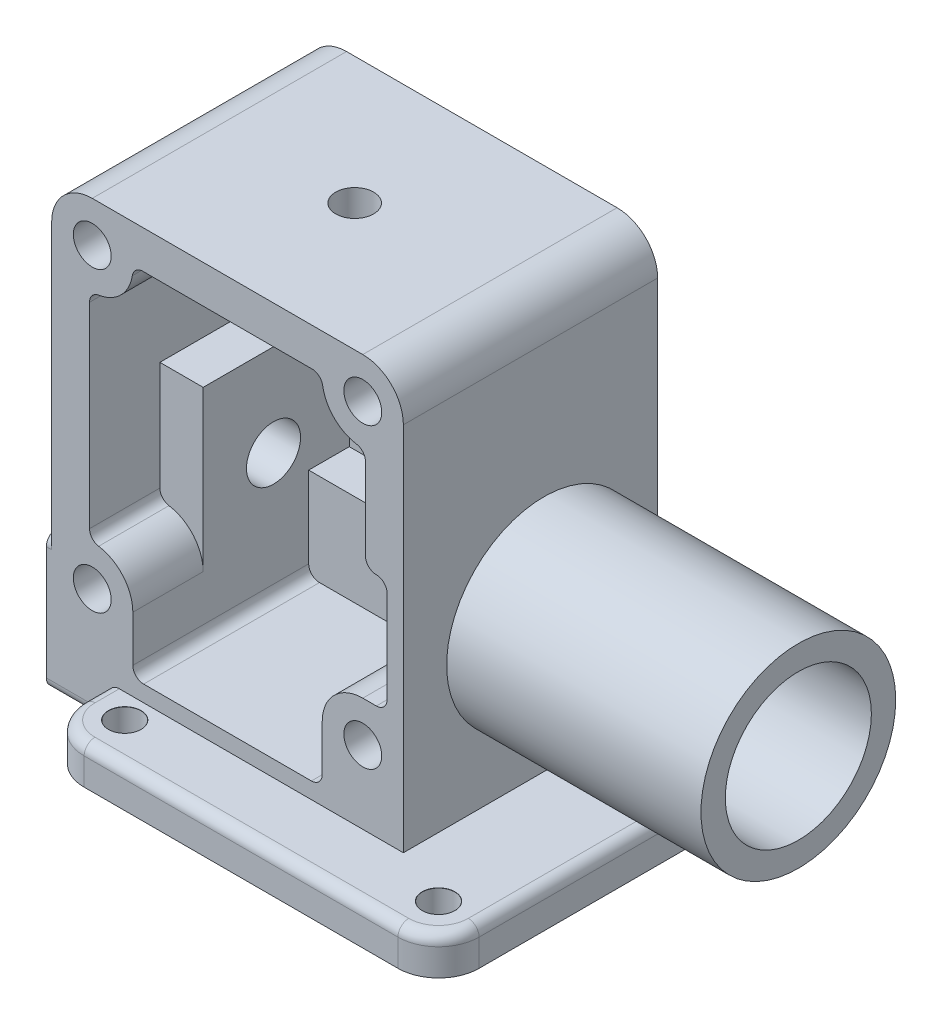
from build123d import *

# Parameters (mm, degrees)
BOSS_EXTRUDE1_DEPTH             = 7
F_6_0MM_DOWEL_HOLE1_D           = 6
F_6_0MM_DOWEL_HOLE1_CSINK_D     = 6.05
F_6_0MM_DOWEL_HOLE1_CSINK_ANGLE = 90
BOSS_EXTRUDE2_DEPTH             = 76
BOSS_EXTRUDE2_DEPTH_BACK        = 7
SKETCH5_W                       = 65
SKETCH5_H                       = 47
FILLET1_R                       = 7.5
F_6_0MM_DOWEL_HOLE2_D           = 7
CUT_EXTRUDE1_DEPTH              = 40
BOSS_EXTRUDE3_START             = 27
BOSS_EXTRUDE3_DEPTH             = 27
BOSS_EXTRUDE4_START             = 7.5
BOSS_EXTRUDE4_DEPTH             = 7.5
F_6_0MM_DOWEL_HOLE3_D           = 6
CUT_EXTRUDE2_DEPTH              = 14.5
BOSS_EXTRUDE5_DEPTH             = 1
F_5_0MM_DOWEL_HOLE1_D           = 5
F_5_0MM_DOWEL_HOLE1_DEPTH       = 13
F_5_0MM_DOWEL_HOLE1_TIP         = 1.502151548
BOSS_EXTRUDE6_DEPTH             = 2
CUT_EXTRUDE4_DEPTH              = 11.5
SKETCH27_R                      = 9
CUT_EXTRUDE5_DEPTH              = 30
SKETCH28_R                      = 5
CUT_EXTRUDE6_DEPTH              = 100
SKETCH29_R                      = 18
BOSS_EXTRUDE7_DEPTH             = 47
SKETCH30_R                      = 13.5
CUT_EXTRUDE7_DEPTH              = 37
SKETCH31_R                      = 12
CUT_EXTRUDE8_DEPTH              = 5
SKETCH32_R                      = 5
CUT_EXTRUDE9_DEPTH              = 116.161842639
SKETCH33_R                      = 3.5
CUT_EXTRUDE10_DEPTH             = 10
FILLET4_R                       = 2


with BuildPart() as part:
    # Sketch2 → Boss-Extrude1 (new body)
    with BuildSketch(Plane(origin=(0, 0, 0), x_dir=(1, 0, 0), z_dir=(0, 1, 0))):
        with BuildLine():
            Line((-29, -36.5), (29, -36.5))
            ThreePointArc((29, -36.5), (34.303300859, -34.303300859), (36.5, -29))
            Line((36.5, -29), (36.5, 29))
            ThreePointArc((36.5, 29), (34.303300859, 34.303300859), (29, 36.5))
            Line((29, 36.5), (-29, 36.5))
            ThreePointArc((-29, 36.5), (-34.303300859, 34.303300859), (-36.5, 29))
            Line((-36.5, 29), (-36.5, -29))
            ThreePointArc((-36.5, -29), (-34.303300859, -34.303300859), (-29, -36.5))
        make_face()
    extrude(amount=BOSS_EXTRUDE1_DEPTH)

    # Ø6.0mm Dowel Hole1 (through all)
    with Locations(Plane(origin=(-29, 7, -29), x_dir=(0, 0, 1), z_dir=(0, 1, 0))):
        with Locations((0, 0), (0, 58), (58, 58), (58, 0)):
            CounterSinkHole(F_6_0MM_DOWEL_HOLE1_D / 2, F_6_0MM_DOWEL_HOLE1_CSINK_D / 2, counter_sink_angle=F_6_0MM_DOWEL_HOLE1_CSINK_ANGLE)

    # Sketch5 → Boss-Extrude2 (add, two sides: drawn at the far end of the back side and taken through both)
    with BuildSketch(Plane(origin=(0, 7, 0), x_dir=(1, 0, 0), z_dir=(0, 1, 0)).offset(-BOSS_EXTRUDE2_DEPTH_BACK)):
        with Locations((-14.5, -1)):
            Rectangle(SKETCH5_W, SKETCH5_H)
    extrude(amount=BOSS_EXTRUDE2_DEPTH + BOSS_EXTRUDE2_DEPTH_BACK)

    # Fillet1
    fillet1_edges = [part.edges().sort_by_distance(p)[0] for p in [
        (18, 83, 1),
        (-47, 83, 1),
    ]]
    fillet(fillet1_edges, radius=FILLET1_R)

    # Ø6.0mm Dowel Hole2 (through all)
    with Locations(Plane(origin=(-39.5, 75.5, 24.5), x_dir=(1, 0, 0), z_dir=(0, 0, 1))):
        with Locations((0, 0), (50, 0), (0, -55), (50, -55)):
            Hole(F_6_0MM_DOWEL_HOLE2_D / 2)

    # Sketch9 → Cut-Extrude1 (cut)
    with BuildSketch(Plane.XY.offset(24.5)):
        with BuildLine():
            Line((11, 66.11916848), (11, 51))
            ThreePointArc((11, 51), (11.585786438, 49.585786438), (13, 49))
            ThreePointArc((13, 49), (14.414213562, 48.414213562), (15, 47))
            Line((15, 47), (15, 30))
            ThreePointArc((15, 30), (14.414213562, 28.585786438), (13, 28))
            Line((13, 28), (10.5, 28))
            ThreePointArc((10.5, 28), (5.196699141, 25.803300859), (3, 20.5))
            Line((3, 20.5), (3, 12))
            ThreePointArc((3, 12), (2.414213562, 10.585786438), (1, 10))
            Line((1, 10), (-30, 10))
            ThreePointArc((-30, 10), (-31.414213562, 10.585786438), (-32, 12))
            Line((-32, 12), (-32, 20.5))
            ThreePointArc((-32, 20.5), (-33.793355673, 25.366642634), (-38.315789474, 27.905919621))
            ThreePointArc((-38.315789474, 27.905919621), (-39.521771821, 28.583060151), (-40, 29.88083152))
            Line((-40, 29.88083152), (-40, 66.11916848))
            ThreePointArc((-40, 66.11916848), (-39.521771821, 67.416939849), (-38.315789474, 68.094080379))
            ThreePointArc((-38.315789474, 68.094080379), (-34.196699141, 70.196699141), (-32.094080379, 74.315789474))
            ThreePointArc((-32.094080379, 74.315789474), (-31.416939849, 75.521771821), (-30.11916848, 76))
            Line((-30.11916848, 76), (1.11916848, 76))
            ThreePointArc((1.11916848, 76), (2.416939849, 75.521771821), (3.094080379, 74.315789474))
            ThreePointArc((3.094080379, 74.315789474), (5.196699141, 70.196699141), (9.315789474, 68.094080379))
            ThreePointArc((9.315789474, 68.094080379), (10.521771821, 67.416939849), (11, 66.11916848))
        make_face()
    extrude(amount=-CUT_EXTRUDE1_DEPTH, mode=Mode.SUBTRACT)

    # Sketch11 → Boss-Extrude3 (add)
    with BuildSketch(Plane.XY.offset(-15.5).offset(BOSS_EXTRUDE3_START)):
        with BuildLine():
            Line((-32, 20.5), (-32, 50))
            Line((-32, 50), (-40, 50))
            Line((-40, 50), (-40, 29.88083152))
            ThreePointArc((-40, 29.88083152), (-39.521771821, 28.583060151), (-38.315789474, 27.905919621))
            ThreePointArc((-38.315789474, 27.905919621), (-33.793355673, 25.366642634), (-32, 20.5))
        make_face()
    extrude(amount=-BOSS_EXTRUDE3_DEPTH)

    # Sketch12 → Boss-Extrude4 (add)
    with BuildSketch(Plane.XY.offset(-15.5).offset(BOSS_EXTRUDE4_START)):
        with BuildLine():
            Line((-9.5, 10), (-9.5, 19.5))
            ThreePointArc((-9.5, 19.5), (-11.696699141, 24.803300859), (-17, 27))
            Line((-17, 27), (-32, 27))
            Line((-32, 27), (-32, 12))
            ThreePointArc((-32, 12), (-31.414213562, 10.585786438), (-30, 10))
            Line((-30, 10), (-9.5, 10))
        make_face()
    extrude(amount=-BOSS_EXTRUDE4_DEPTH)

    # Ø6.0mm Dowel Hole3 (through all)
    with Locations(Plane(origin=(-17, 19.5, -8), x_dir=(1, 0, 0), z_dir=(0, 0, 1))):
        with Locations((0, 0)):
            Hole(F_6_0MM_DOWEL_HOLE3_D / 2)

    # Sketch14 → Cut-Extrude2 (cut)
    with BuildSketch(Plane(origin=(0, 0, -22.5), x_dir=(-1, 0, 0), z_dir=(0, 0, -1))):
        with BuildLine():
            Line((-5.832809465, 48), (-5.832809465, 30))
            ThreePointArc((-5.832809465, 30), (2.167190535, 22), (10.167190535, 30))
            Line((10.167190535, 30), (10.167190535, 48))
            ThreePointArc((10.167190535, 48), (2.167190535, 56), (-5.832809465, 48))
        make_face()
    extrude(amount=-CUT_EXTRUDE2_DEPTH, mode=Mode.SUBTRACT)

    # Sketch15 → Boss-Extrude5 (add)
    with BuildSketch(Plane.ZY.offset(47)):
        with BuildLine():
            Line((24.5, 0), (-22.5, 0))
            Line((-22.5, 0), (-22.5, 23))
            ThreePointArc((-22.5, 23), (-21.914213562, 24.414213562), (-20.5, 25))
            Line((-20.5, 25), (22.5, 25))
            ThreePointArc((22.5, 25), (23.914213562, 24.414213562), (24.5, 23))
            Line((24.5, 23), (24.5, 0))
        make_face()
    extrude(amount=BOSS_EXTRUDE5_DEPTH)

    # Ø5.0mm Dowel Hole1
    with Locations(Plane(origin=(-48, 12.5, 18.5), x_dir=(0, 0, -1), z_dir=(-1, 0, 0))):
        with Locations((0, 0), (37, 0)):
            Hole(F_5_0MM_DOWEL_HOLE1_D / 2, depth=F_5_0MM_DOWEL_HOLE1_DEPTH)
            with Locations((0, 0, -(F_5_0MM_DOWEL_HOLE1_DEPTH + F_5_0MM_DOWEL_HOLE1_TIP / 2))):  # 118° drill point
                Cone(0, F_5_0MM_DOWEL_HOLE1_D / 2, F_5_0MM_DOWEL_HOLE1_TIP, mode=Mode.SUBTRACT)

    # Sketch21 → Boss-Extrude6 (add)
    with BuildSketch(Plane(origin=(0, 0, -22.5), x_dir=(-1, 0, 0), z_dir=(0, 0, -1))):
        Polygon((48, 0), (36.5, 0), (36.5, 7), (-18, 7), (-18, 12), (48, 12), align=None)
    extrude(amount=BOSS_EXTRUDE6_DEPTH)

    # Sketch23 → Cut-Extrude4 (cut)
    with BuildSketch(Plane.ZY.offset(48)):
        with BuildLine():
            Line((-22.5, 0), (-24.5, 0))
            Line((-24.5, 0), (-24.5, 2))
            ThreePointArc((-24.5, 2), (-23.914213562, 0.585786438), (-22.5, 0))
        make_face()
        with BuildLine():
            Line((24.5, 0), (22.5, 0))
            ThreePointArc((22.5, 0), (23.914213562, 0.585786438), (24.5, 2))
            Line((24.5, 2), (24.5, 0))
        make_face()
    extrude(amount=-CUT_EXTRUDE4_DEPTH, mode=Mode.SUBTRACT)

    # Sketch27 → Cut-Extrude5 (cut)
    with BuildSketch(Plane.XZ):
        with Locations(Location((0, 0, 0), (0, 0, 270))):
            Circle(SKETCH27_R)
    extrude(amount=-CUT_EXTRUDE5_DEPTH, mode=Mode.SUBTRACT)

    # Sketch28 → Cut-Extrude6 (cut)
    with BuildSketch(Plane.ZY.offset(47)):
        with Locations(Location((-1.5, 33, 0), (0, 0, 323.130102354))):
            Circle(SKETCH28_R)
    extrude(amount=-CUT_EXTRUDE6_DEPTH, mode=Mode.SUBTRACT)

    # Sketch29 → Boss-Extrude7 (add)
    with BuildSketch(Plane(origin=(18, 0, 0), x_dir=(0, 0, -1), z_dir=(1, 0, 0))):
        with Locations((1.5, 33)):
            Circle(SKETCH29_R)
    extrude(amount=BOSS_EXTRUDE7_DEPTH)

    # Sketch30 → Cut-Extrude7 (cut)
    with BuildSketch(Plane(origin=(65, 0, 0), x_dir=(0, 0, -1), z_dir=(1, 0, 0))):
        with Locations((1.5, 33)):
            Circle(SKETCH30_R)
    extrude(amount=-CUT_EXTRUDE7_DEPTH, mode=Mode.SUBTRACT)

    # Sketch31 → Cut-Extrude8 (cut)
    with BuildSketch(Plane(origin=(28, 0, 0), x_dir=(0, 0, -1), z_dir=(1, 0, 0))):
        with Locations((1.5, 33)):
            Circle(SKETCH31_R)
    extrude(amount=-CUT_EXTRUDE8_DEPTH, mode=Mode.SUBTRACT)

    # Sketch32 → Cut-Extrude9 (cut, through all)
    with BuildSketch(Plane(origin=(23, 0, 0), x_dir=(0, 0, -1), z_dir=(1, 0, 0))):
        with Locations(Location((1.5, 33, 0), (0, 0, 216.869897646))):
            Circle(SKETCH32_R)
    extrude(amount=-CUT_EXTRUDE9_DEPTH, mode=Mode.SUBTRACT)

    # Sketch33 → Cut-Extrude10 (cut)
    with BuildSketch(Plane(origin=(0, 83, 0), x_dir=(1, 0, 0), z_dir=(0, 1, 0))):
        with Locations(Location((-14.5, -1, 0), (0, 0, 270))):
            Circle(SKETCH33_R)
    extrude(amount=-CUT_EXTRUDE10_DEPTH, mode=Mode.SUBTRACT)

    # Fillet4
    fillet4_edges = [part.edges().sort_by_distance(p)[0] for p in [
        (34.303300859, 7, -34.303300859),
        (0, 7, -36.5),
        (-34.303300859, 7, -34.303300859),
        (-36.5, 7, -26.75),
        (-34.303300859, 7, 34.303300859),
        (0, 7, 36.5),
        (34.303300859, 7, 34.303300859),
        (-36.5, 7, 26.75),
        (36.5, 7, 0),
    ]]
    fillet(fillet4_edges, radius=FILLET4_R)


solid = part.part
